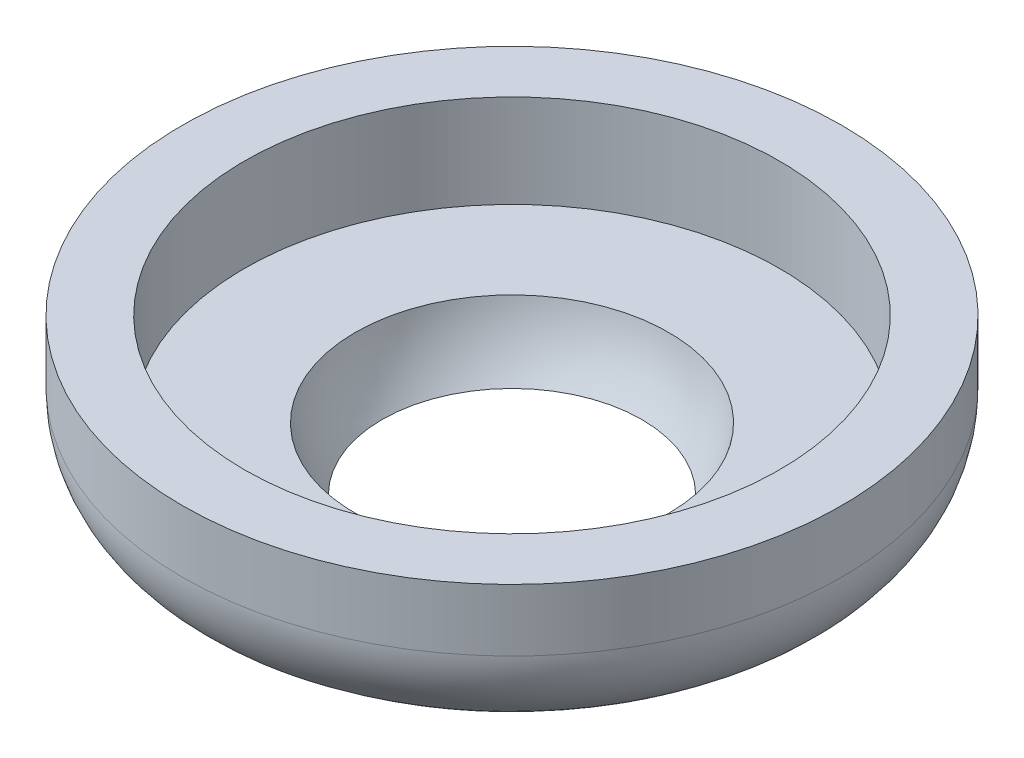
from build123d import *

# Parameters (mm, degrees)
CROQUIS1_R              = 10.625
CROQUIS1_R_2            = 8.625
SALIENTE_EXTRUIR1_DEPTH = 5
CROQUIS1_3_R            = 8.625
SALIENTE_EXTRUIR2_DEPTH = 2
REDONDEO1_R             = 3


with BuildPart() as part:
    # Croquis1 → Saliente-Extruir1 (new body)
    with BuildSketch(Plane(origin=(0, 0, 0), x_dir=(1, 0, 0), z_dir=(0, 1, 0))):
        Circle(CROQUIS1_R)
        Circle(CROQUIS1_R_2, mode=Mode.SUBTRACT)
    extrude(amount=SALIENTE_EXTRUIR1_DEPTH)

    # Croquis1<3> → Saliente-Extruir2 (add)
    with BuildSketch(Plane(origin=(0, 0, 0), x_dir=(1, 0, 0), z_dir=(0, 1, 0))):
        Circle(CROQUIS1_3_R)
    extrude(amount=SALIENTE_EXTRUIR2_DEPTH)

    # Croquis2 → Cortar-Revolución1 (revolve, cut)
    with BuildSketch(Plane.XY):
        with BuildLine():
            Line((0, 8.15), (0, -2.15))
            ThreePointArc((0, -2.15), (-5.15, 3), (0, 8.15))
        make_face()
    revolve(axis=Axis((0, 8.15, 0), (0, -1, 0)), mode=Mode.SUBTRACT)

    # Redondeo1
    redondeo1_edges = [part.edges().sort_by_distance(p)[0] for p in [
        (-10.625, 0, 0),
    ]]
    fillet(redondeo1_edges, radius=REDONDEO1_R)


solid = part.part
